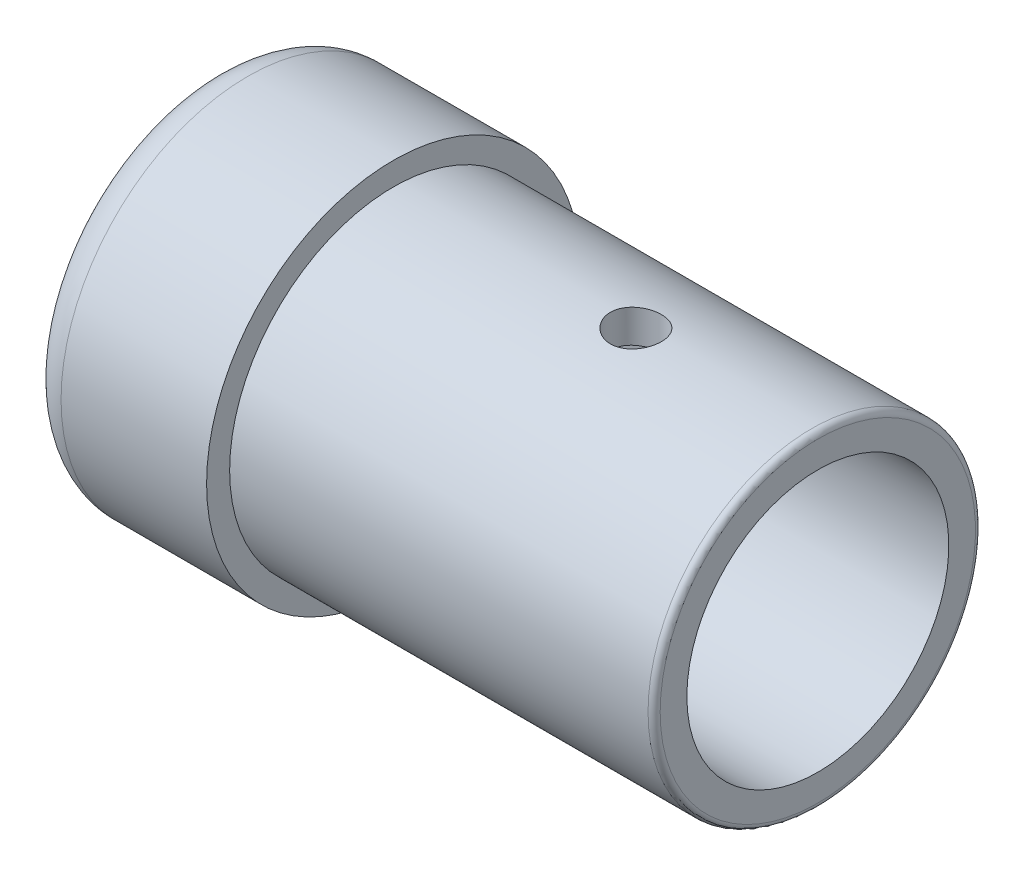
from build123d import *

# Parameters (mm, degrees)
ESBO_O3_W = 2.1
ESBO_O3_H = 15.4
FILETE1_R = 3
FILETE2_R = 0.5


with BuildPart() as part:
    # Esboço1 → Revolução1 (revolve)
    with BuildSketch(Plane.XY, mode=Mode.PRIVATE) as revolu_o1_sk:
        Polygon((0, 10.8), (0, 15.4), (15, 15.4), (15, 13.5), (50, 13.5), (50, 10.8), align=None)
    revolve(revolu_o1_sk.sketch.rotate(Axis((0, 0, 0), (1, 0, 0)), 90), axis=Axis((0, 0, 0), (1, 0, 0)))

    # Esboço3 → Furo roscado de M51 (revolve, cut)
    with BuildSketch(Plane(origin=(35, 0, 0), x_dir=(0, 0, -1), z_dir=(1, 0, 0))):
        with Locations((1.05, 7.7)):
            Rectangle(ESBO_O3_W, ESBO_O3_H)
    revolve(axis=Axis((35, -6.35, 0), (0, 1, 0)), mode=Mode.SUBTRACT)

    # Filete1
    filete1_edges = [part.edges().sort_by_distance(p)[0] for p in [
        (0, 0, -15.4),
    ]]
    fillet(filete1_edges, radius=FILETE1_R)

    # Filete2
    filete2_edges = [part.edges().sort_by_distance(p)[0] for p in [
        (50, 0, -13.5),
    ]]
    fillet(filete2_edges, radius=FILETE2_R)


solid = part.part
